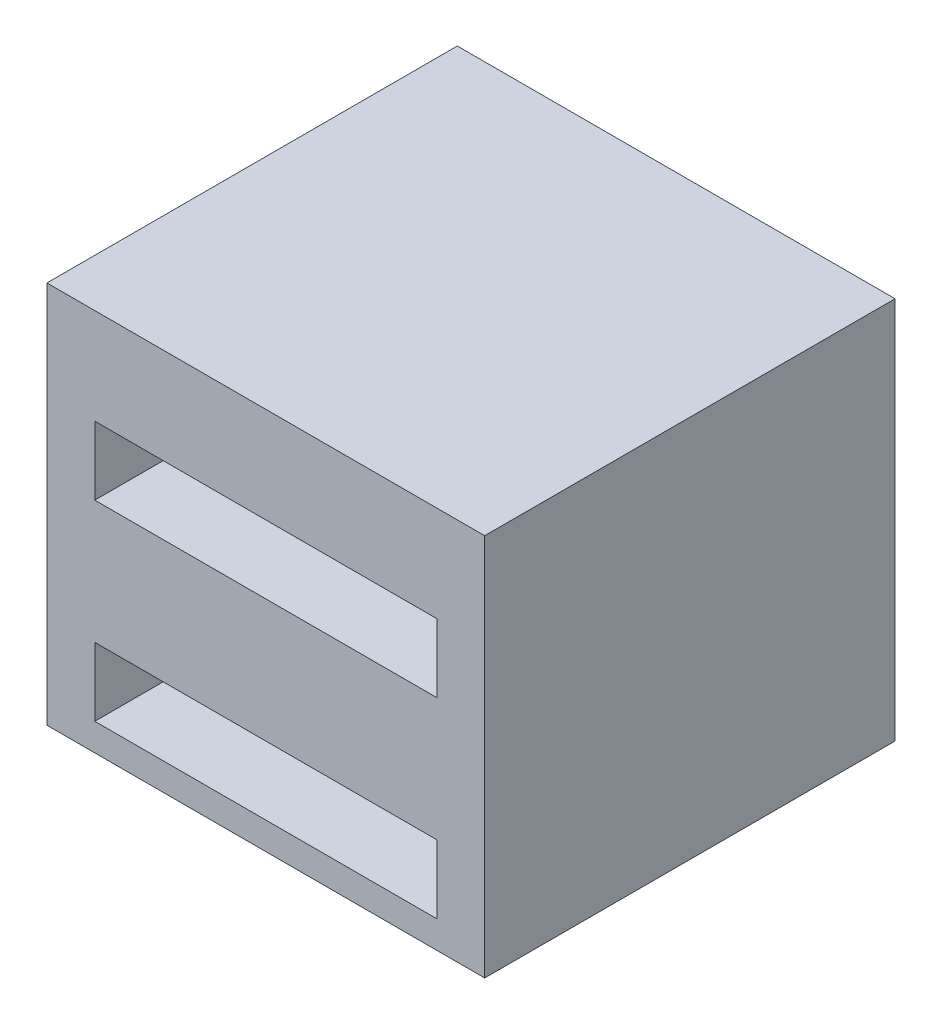
from build123d import *

# Parameters (mm, degrees)
SKETCH1_W                                      = 640
SKETCH1_H                                      = 560
OVEN_OMAKE_FIRIN_SATIN_ALINAN_64X60X56_1_DEPTH = 600
OVEN_OMAKE_FIRIN_SATIN_ALINAN_64X60X56_2_START = 1
SKETCH2_W                                      = 500
SKETCH2_H                                      = 100
OVEN_OMAKE_FIRIN_SATIN_ALINAN_64X60X56_2_DEPTH = 421
OVEN_OMAKE_FIRIN_SATIN_ALINAN_64X60X56_3_START = 1
SKETCH3_W                                      = 500
SKETCH3_H                                      = 100
OVEN_OMAKE_FIRIN_SATIN_ALINAN_64X60X56_3_DEPTH = 421


with BuildPart() as part:
    # Sketch1 → OVEN_OMAKE_firin_SATIN_ALINAN_64x60x56_1 (new body)
    with BuildSketch(Plane.XY):
        with Locations((350, 1400)):
            Rectangle(SKETCH1_W, SKETCH1_H)
    extrude(amount=-OVEN_OMAKE_FIRIN_SATIN_ALINAN_64X60X56_1_DEPTH)

    # Sketch2 → OVEN_OMAKE_firin_SATIN_ALINAN_64x60x56_2 (cut)
    with BuildSketch(Plane.XY.offset(OVEN_OMAKE_FIRIN_SATIN_ALINAN_64X60X56_2_START)):
        with Locations((350, 1210)):
            Rectangle(SKETCH2_W, SKETCH2_H)
    extrude(amount=-OVEN_OMAKE_FIRIN_SATIN_ALINAN_64X60X56_2_DEPTH, mode=Mode.SUBTRACT)

    # Sketch3 → OVEN_OMAKE_firin_SATIN_ALINAN_64x60x56_3 (cut)
    with BuildSketch(Plane.XY.offset(OVEN_OMAKE_FIRIN_SATIN_ALINAN_64X60X56_3_START)):
        with Locations((350, 1490)):
            Rectangle(SKETCH3_W, SKETCH3_H)
    extrude(amount=-OVEN_OMAKE_FIRIN_SATIN_ALINAN_64X60X56_3_DEPTH, mode=Mode.SUBTRACT)


solid = part.part
